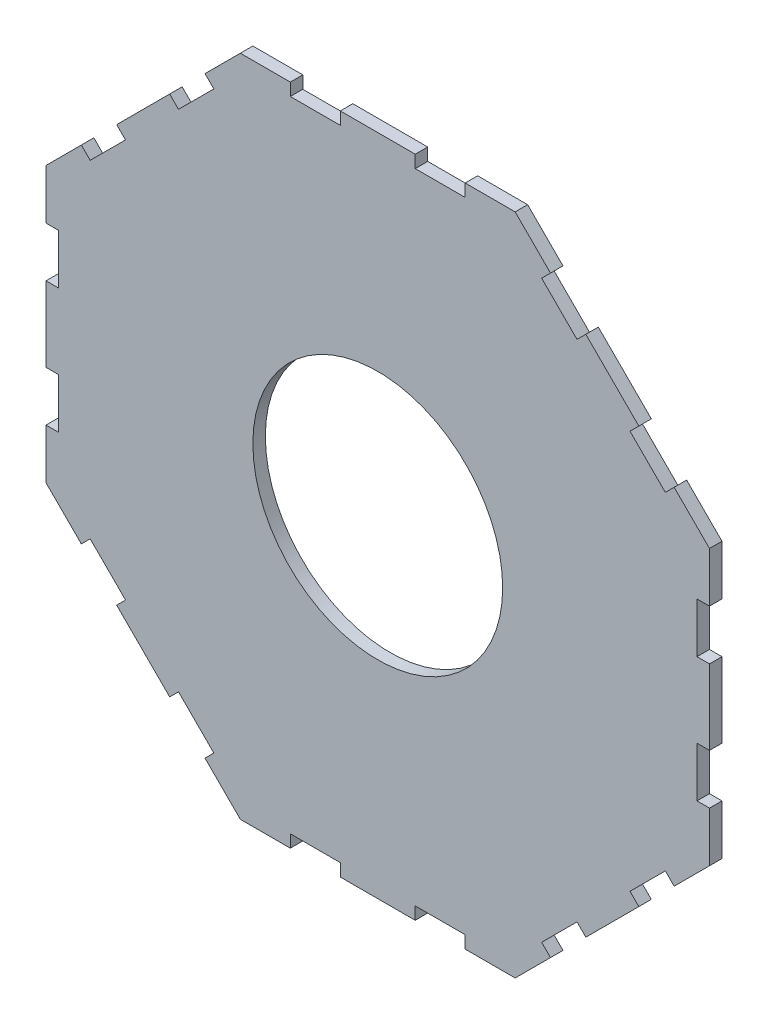
from build123d import *

# Parameters (mm, degrees)
SKETCH1_R           = 31.75
BOSS_EXTRUDE1_DEPTH = 3.175


with BuildPart() as part:
    # Sketch1 → Boss-Extrude1 (new body)
    with BuildSketch(Plane.XY):
        Polygon((41.660192091, 73.091088515), (43.905256121, 75.336152545), (34.925, 84.316408666), (22.225, 84.316408666), (22.225, 81.141408666), (9.525, 81.141408666), (9.525, 84.316408666), (-9.525, 84.316408666), (-9.525, 81.141408666), (-22.225, 81.141408666), (-22.225, 84.316408666), (-34.925, 84.316408666), (-43.905256121, 75.336152545), (-41.660192091, 73.091088515), (-50.640448212, 64.110832393), (-52.885512242, 66.355896424), (-66.355896424, 52.885512242), (-64.110832393, 50.640448212), (-73.091088515, 41.660192091), (-75.336152545, 43.905256121), (-84.316408666, 34.925), (-84.316408666, 22.225), (-81.141408666, 22.225), (-81.141408666, 9.525), (-84.316408666, 9.525), (-84.316408666, -9.525), (-81.141408666, -9.525), (-81.141408666, -22.225), (-84.316408666, -22.225), (-84.316408666, -34.925), (-75.336152545, -43.905256121), (-73.091088515, -41.660192091), (-64.110832393, -50.640448212), (-66.355896424, -52.885512242), (-52.885512242, -66.355896424), (-50.640448212, -64.110832393), (-41.660192091, -73.091088515), (-43.905256121, -75.336152545), (-34.925, -84.316408666), (-22.225, -84.316408666), (-22.225, -81.141408666), (-9.525, -81.141408666), (-9.525, -84.316408666), (9.525, -84.316408666), (9.525, -81.141408666), (22.225, -81.141408666), (22.225, -84.316408666), (34.925, -84.316408666), (43.905256121, -75.336152545), (41.660192091, -73.091088515), (50.640448212, -64.110832393), (52.885512242, -66.355896424), (66.355896424, -52.885512242), (64.110832393, -50.640448212), (73.091088515, -41.660192091), (75.336152545, -43.905256121), (84.316408666, -34.925), (84.316408666, -22.225), (81.141408666, -22.225), (81.141408666, -9.525), (84.316408666, -9.525), (84.316408666, 9.525), (81.141408666, 9.525), (81.141408666, 22.225), (84.316408666, 22.225), (84.316408666, 34.925), (75.336152545, 43.905256121), (73.091088515, 41.660192091), (64.110832393, 50.640448212), (66.355896424, 52.885512242), (52.885512242, 66.355896424), (50.640448212, 64.110832393), align=None)
        Circle(SKETCH1_R, mode=Mode.SUBTRACT)
    extrude(amount=BOSS_EXTRUDE1_DEPTH)


solid = part.part
